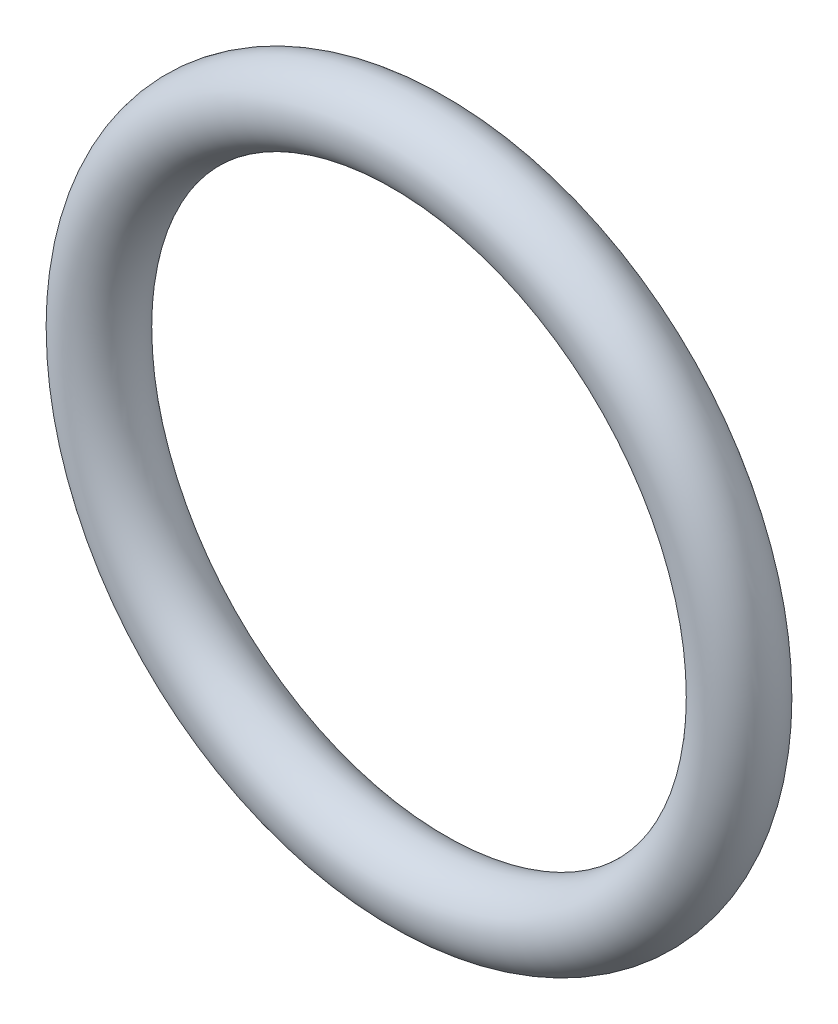
from build123d import *

# Parameters (mm, degrees)
ESBO_O6_R = 1.25


with BuildPart() as part:
    # Esboço6 → Revolução1 (revolve)
    with BuildSketch(Plane(origin=(0, 0, 0), x_dir=(1, 0, 0), z_dir=(0, 1, 0)), mode=Mode.PRIVATE) as revolu_o1_sk:
        with Locations((10.710965158, 0)):
            Circle(ESBO_O6_R)
    revolve(revolu_o1_sk.sketch.rotate(Axis((0, 0, -2.043680535), (0, 0, 1)), 180), axis=Axis((0, 0, -2.043680535), (0, 0, 1)))


solid = part.part
